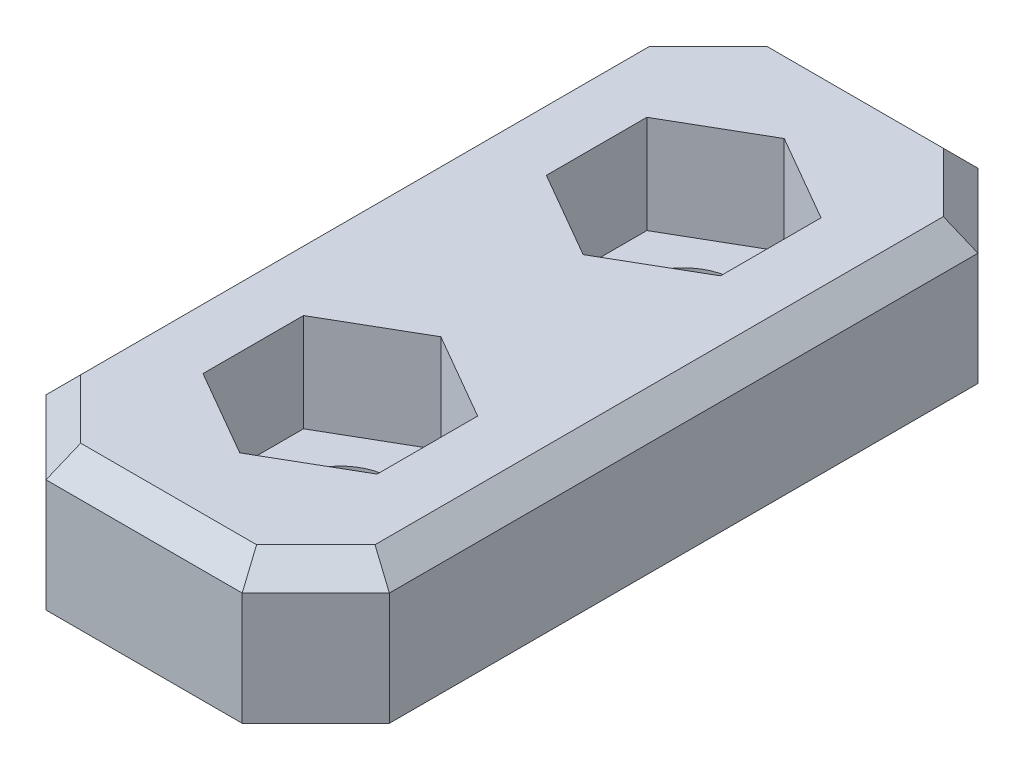
from build123d import *

# Parameters (mm, degrees)
SKETCH1_W           = 14
SKETCH1_H           = 30
SKETCH1_R           = 2.1
BOSS_EXTRUDE1_DEPTH = 5.6
CUT_EXTRUDE1_DEPTH  = 4
CHAMFER1_SIZE       = 3
CHAMFER2_SIZE       = 1


with BuildPart() as part:
    # Sketch1 → Boss-Extrude1 (new body)
    with BuildSketch(Plane(origin=(0, 0, 0), x_dir=(1, 0, 0), z_dir=(0, 1, 0))):
        with Locations((7, 15)):
            Rectangle(SKETCH1_W, SKETCH1_H)
        with Locations(Location((7, 22, 0), (0, 0, 270))):
            Circle(SKETCH1_R, mode=Mode.SUBTRACT)
        with Locations(Location((7, 8, 0), (0, 0, 270))):
            Circle(SKETCH1_R, mode=Mode.SUBTRACT)
    extrude(amount=BOSS_EXTRUDE1_DEPTH)

    # Sketch2 → Cut-Extrude1 (cut)
    with BuildSketch(Plane(origin=(0, 5.6, 0), x_dir=(1, 0, 0), z_dir=(0, 1, 0))):
        Polygon((10.55, 24.049593456), (7, 26.099186911), (3.45, 24.049593456), (3.45, 19.950406544), (7, 17.900813089), (10.55, 19.950406544), align=None)
        Polygon((10.55, 10.049593456), (7, 12.099186911), (3.45, 10.049593456), (3.45, 5.950406544), (7, 3.900813089), (10.55, 5.950406544), align=None)
    extrude(amount=-CUT_EXTRUDE1_DEPTH, mode=Mode.SUBTRACT)

    # Chamfer1
    chamfer1_edges = [part.edges().sort_by_distance(p)[0] for p in [
        (0, 2.8, -30),
        (14, 2.8, -30),
        (14, 2.8, 0),
        (0, 2.8, 0),
    ]]
    chamfer(chamfer1_edges, length=CHAMFER1_SIZE)

    # Chamfer2
    chamfer2_edges = [part.edges().sort_by_distance(p)[0] for p in [
        (7, 5.6, -30),
        (14, 5.6, -15),
        (0, 5.6, -15),
        (7, 5.6, 0),
        (12.5, 5.6, -1.5),
        (1.5, 5.6, -1.5),
        (1.5, 5.6, -28.5),
        (12.5, 5.6, -28.5),
    ]]
    chamfer(chamfer2_edges, length=CHAMFER2_SIZE)


solid = part.part
